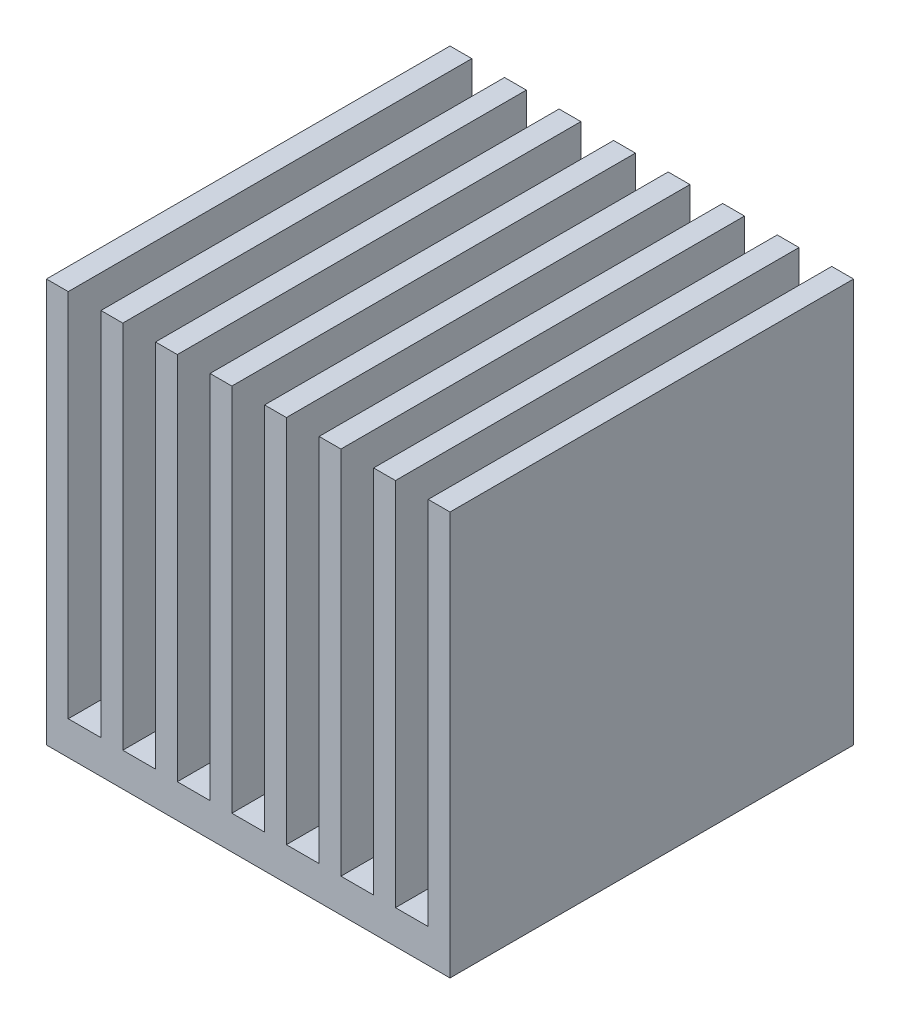
from build123d import *

# Parameters (mm, degrees)
SKETCH1_W           = 12
SKETCH1_H           = 12
BOSS_EXTRUDE1_DEPTH = 12
SKETCH2_W           = 0.972972973
SKETCH2_H           = 11
CUT_EXTRUDE1_DEPTH  = 21.784609691
LPATTERN1_COUNT     = 7
LPATTERN1_PITCH     = 1.621621622


with BuildPart() as part:
    # Sketch1 → Boss-Extrude1 (new body)
    with BuildSketch(Plane(origin=(0, 0, 0), x_dir=(1, 0, 0), z_dir=(0, 1, 0))):
        with Locations((-6, -6)):
            Rectangle(SKETCH1_W, SKETCH1_H)
    extrude(amount=BOSS_EXTRUDE1_DEPTH)

    # Sketch2 → Cut-Extrude1 (cut, through all)
    with BuildSketch(Plane.XY.offset(12)):
        with Locations((-10.864864864, 6.5)):
            Rectangle(SKETCH2_W, SKETCH2_H)
    cut_extrude1 = extrude(amount=-CUT_EXTRUDE1_DEPTH, mode=Mode.SUBTRACT)

    # LPattern1: Cut-Extrude1 ×7
    with Locations(*[(i * LPATTERN1_PITCH, 0, 0) for i in range(1, LPATTERN1_COUNT)]):
        add(cut_extrude1, mode=Mode.SUBTRACT)


solid = part.part
